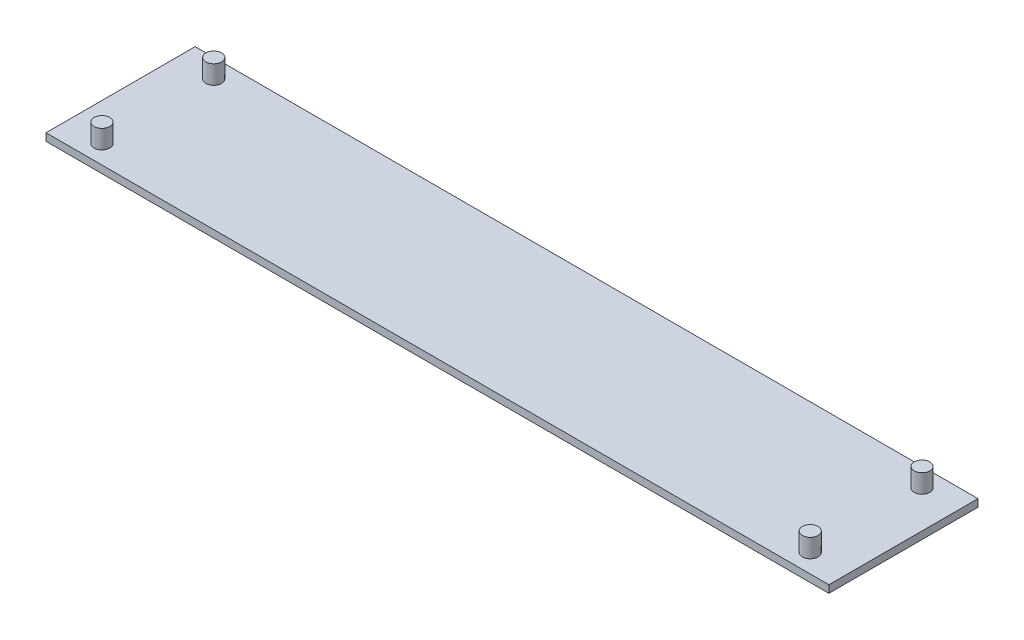
from build123d import *

# Parameters (mm, degrees)
SKETCH_1_W      = 210
SKETCH_1_H      = 40
EXTRUDE_1_DEPTH = 2
SKETCH_2_R      = 2.1
EXTRUDE_2_DEPTH = 5


with BuildPart() as part:
    # 草图1 → 凸台-拉伸1 (new body)
    with BuildSketch(Plane(origin=(0, 0, 0), x_dir=(1, 0, 0), z_dir=(0, 1, 0))):
        Rectangle(SKETCH_1_W, SKETCH_1_H)
    extrude(amount=EXTRUDE_1_DEPTH)

    # 草图2 → 凸台-拉伸2 (add)
    with BuildSketch(Plane(origin=(0, 2, 0), x_dir=(1, 0, 0), z_dir=(0, 1, 0))):
        with Locations(Location((95, -15, 0), (0, 0, 270))):
            Circle(SKETCH_2_R)
        with Locations(Location((95, 15, 0), (0, 0, 270))):
            Circle(SKETCH_2_R)
        with Locations(Location((-95, 15, 0), (0, 0, 270))):
            Circle(SKETCH_2_R)
        with Locations(Location((-95, -15, 0), (0, 0, 270))):
            Circle(SKETCH_2_R)
    extrude(amount=EXTRUDE_2_DEPTH)


solid = part.part
